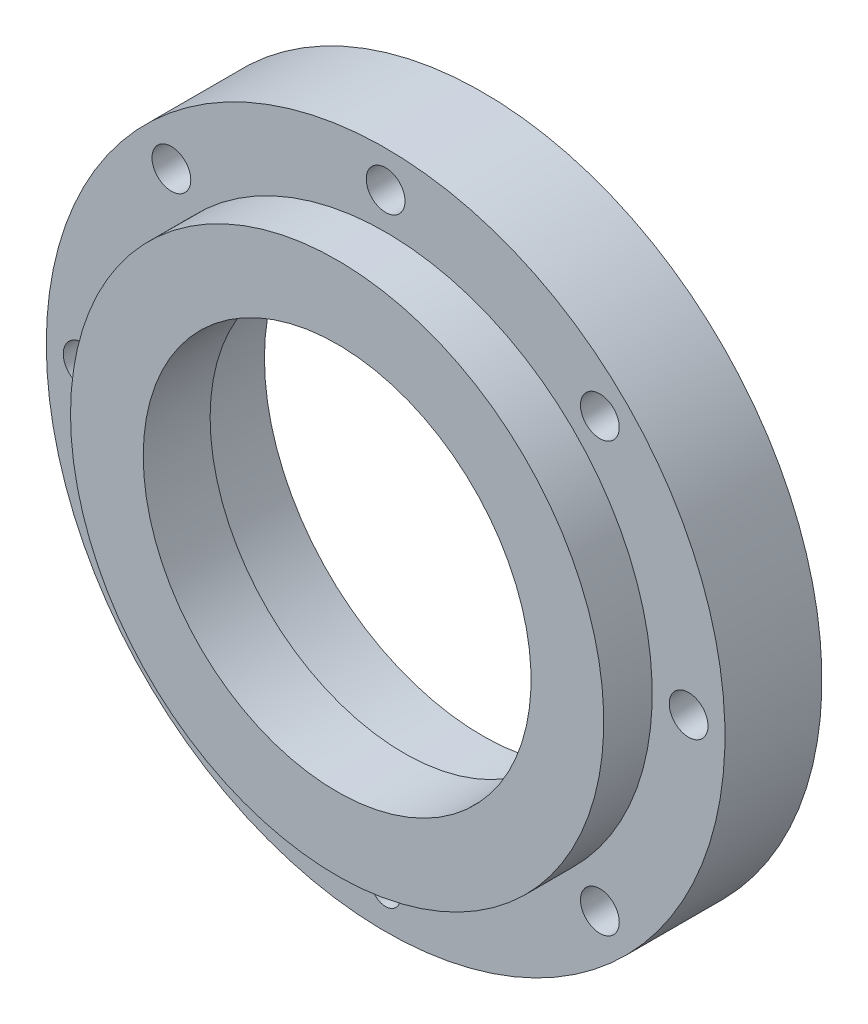
from build123d import *

# Parameters (mm, degrees)
SKETCH2_R             = 3
CUT_EXTRUDE1_DEPTH    = 9
SKETCH3_R             = 4
CUT_EXTRUDE2_DEPTH    = 10
F_8_0MM_DOWEL_HOLE1_D = 8


with BuildPart() as part:
    # Sketch1 → Revolve1 (revolve)
    with BuildSketch(Plane(origin=(0, 0, 0), x_dir=(1, 0, 0), z_dir=(0, 1, 0))):
        Polygon((-55, -19.79575879), (-55, -9.79575879), (-70, -9.79575879), (-70, 10.20424121), (-45, 10.20424121), (-45, -6), (-40, -6), (-40, -19.79575879), align=None)
    revolve(axis=Axis((0, 0, -52.707374268), (0, 0, 1)))

    # Sketch2 → Cut-Extrude1 (cut)
    with BuildSketch(Plane.XY.offset(9.79575879)):
        with Locations((0, -62.5)):
            Circle(SKETCH2_R)
    extrude(amount=-CUT_EXTRUDE1_DEPTH, mode=Mode.SUBTRACT)

    # Sketch3 → Cut-Extrude2 (cut)
    with BuildSketch(Plane.XY.offset(9.79575879)):
        with Locations((0, 62.5)):
            Circle(SKETCH3_R)
    extrude(amount=-CUT_EXTRUDE2_DEPTH, mode=Mode.SUBTRACT)

    # Ø8.0mm Dowel Hole1 (through all)
    with Locations(Plane.XY.offset(9.79575879)):
        with Locations((44.194173824, 44.194173824), (62.5, 0), (44.194173824, -44.194173824), (-44.194173824, -44.194173824), (-62.5, 0), (-44.194173824, 44.194173824)):
            Hole(F_8_0MM_DOWEL_HOLE1_D / 2)


solid = part.part
